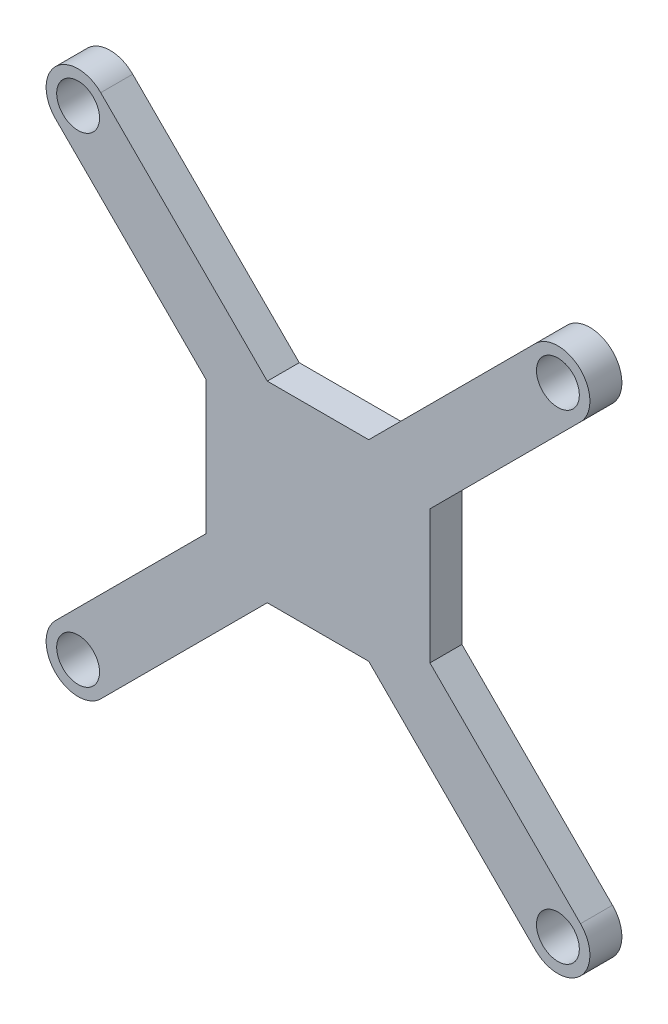
from build123d import *

# Parameters (mm, degrees)
EXTRUDE_1_DEPTH     = 5
SKETCH_4_R          = 3.35
CUT_EXTRUDE_1_DEPTH = 5


with BuildPart() as part:
    # 草图1 → 凸台-拉伸1 (new body)
    with BuildSketch(Plane.XY):
        with BuildLine():
            Line((33.882068439, 36.885004962), (7.846534534, 10.849471056))
            Line((7.846534534, 10.849471056), (-8.011329843, 10.849471056))
            Line((-8.011329843, 10.849471056), (-34.046863749, 36.885004962))
            ThreePointArc((-34.046863749, 36.885004962), (-41.117931561, 36.885004962), (-41.117931561, 29.81393715))
            Line((-41.117931561, 29.81393715), (-17.582397655, 6.278403244))
            Line((-17.582397655, 6.278403244), (-17.582397655, -14.579461132))
            Line((-17.582397655, -14.579461132), (-41.117931561, -38.114995038))
            ThreePointArc((-41.117931561, -38.114995038), (-41.117931561, -45.18606285), (-34.046863749, -45.18606285))
            Line((-34.046863749, -45.18606285), (-8.011329843, -19.150528944))
            Line((-8.011329843, -19.150528944), (7.846534534, -19.150528944))
            Line((7.846534534, -19.150528944), (33.882068439, -45.18606285))
            ThreePointArc((33.882068439, -45.18606285), (40.953136251, -45.18606285), (40.953136251, -38.114995038))
            Line((40.953136251, -38.114995038), (17.417602345, -14.579461132))
            Line((17.417602345, -14.579461132), (17.417602345, 6.278403244))
            Line((17.417602345, 6.278403244), (40.953136251, 29.81393715))
            ThreePointArc((40.953136251, 29.81393715), (40.953136251, 36.885004962), (33.882068439, 36.885004962))
        make_face()
    extrude(amount=EXTRUDE_1_DEPTH)

    # 草图4 → 切除-拉伸1 (cut)
    with BuildSketch(Plane.XY.offset(5)):
        with Locations((-37.582397655, 33.349471056)):
            Circle(SKETCH_4_R)
        with Locations((37.417602345, 33.349471056)):
            Circle(SKETCH_4_R)
        with Locations((37.417602345, -41.650528944)):
            Circle(SKETCH_4_R)
        with Locations((-37.582397655, -41.650528944)):
            Circle(SKETCH_4_R)
    extrude(amount=-CUT_EXTRUDE_1_DEPTH, mode=Mode.SUBTRACT)


solid = part.part
